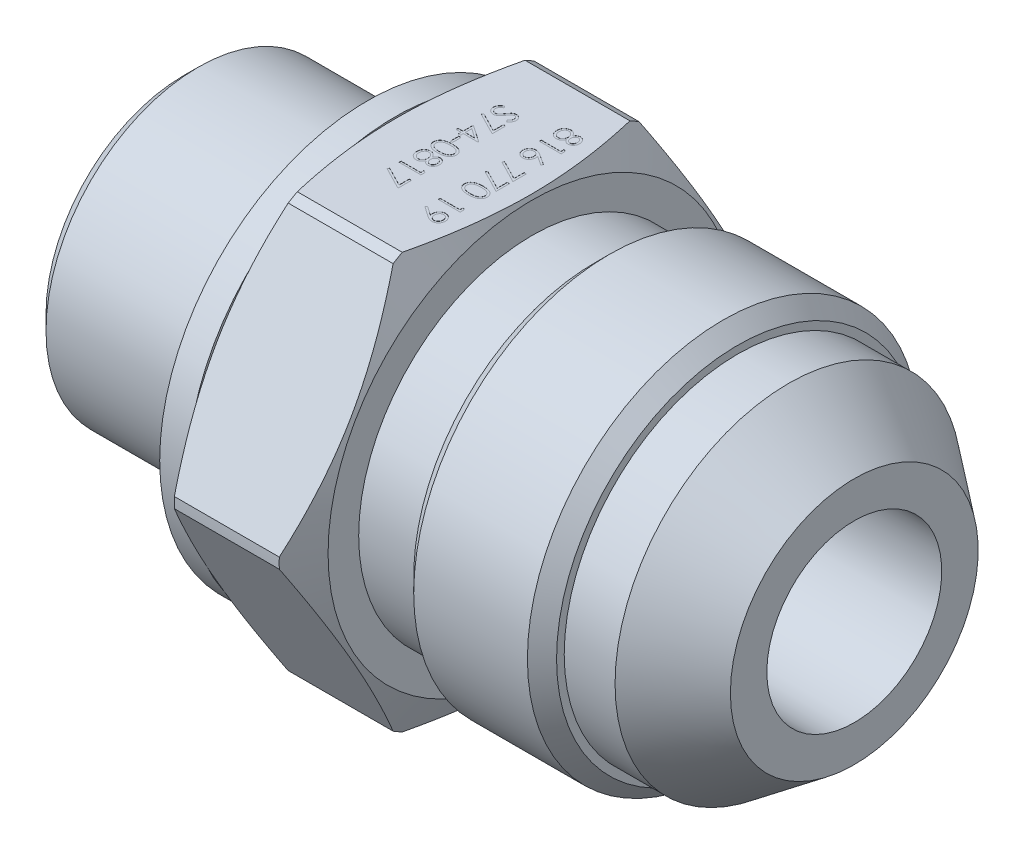
from build123d import *

# Parameters (mm, degrees)
SKETCH2_OUTSIDE_W  = 47.506
SKETCH2_OUTSIDE_H  = 47.506
EXTRUDE1_DEPTH     = 9.4
SKETCH3_R          = 14.25
SKETCH3_R_2        = 11.5
EXTRUDE2_DEPTH     = 1.9
CHAMFER1_SIZE      = 1
CHAMFER2_SIZE      = 1
SKETCH4_W          = 0.153846154
SKETCH4_H          = 0.576923077
CUT_EXTRUDE1_DEPTH = 0.01
SKETCH5_R          = 1.25


with BuildPart() as part:
    # Sketch1 → Revolve1 (revolve)
    with BuildSketch(Plane.XY, mode=Mode.PRIVATE) as revolve1_sk:
        Polygon((0, 7.9), (0, 10.45), (11.55, 10.45), (12.5, 9.5), (14.5, 9.5), (14.5, 14), (15.6, 16.25), (22.8, 16.25), (23.9, 14), (23.9, 11.9), (28.2, 11.9), (28.2, 13.425), (38, 13.425), (38, 11.9), (41.488047606, 11.9), (46, 8.5), (46, 6), (3.290896534, 6), align=None)
    revolve(revolve1_sk.sketch.rotate(Axis((0, 0, 0), (1, 0, 0)), 90), axis=Axis((0, 0, 0), (1, 0, 0)))

    # Sketch2 outside → Extrude1 (cut)
    with BuildSketch(Plane(origin=(23.9, 0, 0), x_dir=(0, 0, -1), z_dir=(1, 0, 0))):
        Rectangle(SKETCH2_OUTSIDE_W, SKETCH2_OUTSIDE_H)
        Polygon((8.227241336, 14.25), (-8.227241336, 14.25), (-16.454482672, 0), (-8.227241336, -14.25), (8.227241336, -14.25), (16.454482672, 0), align=None, mode=Mode.SUBTRACT)
    extrude(amount=-EXTRUDE1_DEPTH, mode=Mode.SUBTRACT)

    # Sketch3 → Extrude2 (add)
    with BuildSketch(Plane.ZY.offset(-14.5)):
        with Locations(Location((0, 0, 0), (0, 0, 180))):
            Circle(SKETCH3_R)
        with Locations(Location((0, 0, 0), (0, 0, 180))):
            Circle(SKETCH3_R_2, mode=Mode.SUBTRACT)
    extrude(amount=EXTRUDE2_DEPTH)

    # Chamfer1
    chamfer1_edges = [part.edges().sort_by_distance(p)[0] for p in [
        (0, 0, -10.45),
    ]]
    chamfer(chamfer1_edges, length=CHAMFER1_SIZE)

    # Chamfer2
    chamfer2_edges = [part.edges().sort_by_distance(p)[0] for p in [
        (28.2, 0, -13.425),
        (38, 0, -13.425),
    ]]
    chamfer(chamfer2_edges, length=CHAMFER2_SIZE)

    # Sketch4 → Cut-Extrude1 (cut)
    # profile 1 of 16: a face of its own
    with BuildSketch(Plane(origin=(0, 14.25, 0), x_dir=(1, 0, 0), z_dir=(0, 1, 0))):
        with BuildLine():
            add(Edge.make_bspline(
                [(21.735637019, 4.509366678), (21.729227212, 4.497192529), (21.716686842, 4.473374603), (21.696559613, 4.439295667), (21.675534084, 4.407919761), (21.654270264, 4.378799736), (21.631927656, 4.352529543), (21.608761289, 4.32893535), (21.585391714, 4.307276947), (21.560904519, 4.288692996), (21.535804758, 4.272305371), (21.509876674, 4.258161919), (21.48320205, 4.246067611), (21.455483119, 4.236483819), (21.4271288, 4.228588677), (21.3977725, 4.223156298), (21.367607789, 4.220234756), (21.347221373, 4.219682408), (21.336899038, 4.219402736)],
                knots=[0, 0, 0, 0, 1.264385854, 2.473688339, 3.635349404, 4.734491366, 5.785876313, 6.801388178, 7.772322209, 8.711311751, 9.622826105, 10.524996139, 11.423212571, 12.31118177, 13.217849097, 14.126010572, 15.051135535, 16, 16, 16, 16], degree=3))
            add(Edge.make_bspline(
                [(21.336899038, 4.219402736), (21.322456161, 4.219730404), (21.293868288, 4.220378981), (21.251691516, 4.226121731), (21.210631818, 4.234503155), (21.171086154, 4.247554843), (21.132558966, 4.263144272), (21.095754694, 4.28319916), (21.059644198, 4.305705114), (21.03743814, 4.32381892), (21.026201923, 4.332984466)],
                knots=[0, 0, 0, 0, 1.02534174, 2.029536028, 3.018826961, 3.997522084, 4.983122576, 5.966563916, 6.971085759, 8, 8, 8, 8], degree=3))
            add(Edge.make_bspline(
                [(21.026201923, 4.332984466), (21.013090306, 4.344914384), (20.987029094, 4.368626798), (20.953193033, 4.409248052), (20.924757578, 4.45382886), (20.901583909, 4.502196717), (20.883547113, 4.554222331), (20.870586034, 4.609894619), (20.863162135, 4.669322113), (20.862088997, 4.710167315), (20.861538462, 4.731121486)],
                knots=[0, 0, 0, 0, 0.954267603, 1.896743057, 2.838368354, 3.796610408, 4.779680527, 5.799409237, 6.871065594, 8, 8, 8, 8], degree=3))
            add(Edge.make_bspline(
                [(20.861538462, 4.731121486), (20.862033706, 4.751269617), (20.862997402, 4.790475833), (20.869491053, 4.847549883), (20.880987296, 4.900816454), (20.89639689, 4.950528083), (20.916945933, 4.99620412), (20.942133121, 5.037927447), (20.971389543, 5.076310199), (21.005420286, 5.110146039), (21.041874677, 5.140183513), (21.07948225, 5.166569931), (21.118248041, 5.188501651), (21.15759361, 5.207070413), (21.198070538, 5.221285278), (21.239470542, 5.231130512), (21.281721318, 5.237383075), (21.310234884, 5.23821499), (21.324579327, 5.238633505)],
                knots=[0, 0, 0, 0, 1.256882982, 2.445766618, 3.576898315, 4.651879663, 5.686612882, 6.692806257, 7.686348993, 8.689277895, 9.678883454, 10.630458183, 11.551151498, 12.454054546, 13.341321255, 14.221808008, 15.105437234, 16, 16, 16, 16], degree=3))
            add(Edge.make_bspline(
                [(21.324579327, 5.238633505), (21.335104703, 5.238385853), (21.355906561, 5.237896407), (21.386639015, 5.234508442), (21.416552071, 5.229062599), (21.445753667, 5.221663321), (21.47404064, 5.211647372), (21.501511827, 5.199510817), (21.5283783, 5.185496446), (21.554178192, 5.168698688), (21.579771328, 5.150205174), (21.603907634, 5.128267663), (21.627931697, 5.104207356), (21.650803997, 5.0770419), (21.673623867, 5.047602762), (21.694939086, 5.014997665), (21.716309228, 4.980142662), (21.729083881, 4.95536856), (21.735637019, 4.942659947)],
                knots=[0, 0, 0, 0, 0.941717298, 1.86116577, 2.762973304, 3.660719123, 4.553575492, 5.444450535, 6.34648071, 7.261375261, 8.197060099, 9.168336537, 10.175980388, 11.237504102, 12.343496232, 13.506792996, 14.721035322, 16, 16, 16, 16], degree=3))
            add(Edge.make_bspline(
                [(21.735637019, 4.942659947), (21.745121871, 4.960058053), (21.763487198, 4.993745654), (21.797255848, 5.038322435), (21.833695599, 5.076673508), (21.874010797, 5.107312609), (21.916425811, 5.131624986), (21.960804719, 5.148793548), (22.006616128, 5.160004831), (22.037856205, 5.161140213), (22.053545673, 5.161710428)],
                knots=[0, 0, 0, 0, 1.16709546, 2.25982348, 3.287408737, 4.277418348, 5.234967981, 6.16072867, 7.076276605, 8, 8, 8, 8], degree=3))
            add(Edge.make_bspline(
                [(22.053545673, 5.161710428), (22.069530324, 5.161009518), (22.10166226, 5.159600568), (22.149493717, 5.148207925), (22.196471198, 5.129641344), (22.242373504, 5.104392807), (22.285621893, 5.072928338), (22.324541722, 5.035187025), (22.358339628, 4.991814641), (22.386893207, 4.943581266), (22.41024827, 4.891776215), (22.426191341, 4.837022914), (22.436677394, 4.780299822), (22.437861271, 4.741685776), (22.438461538, 4.722107062)],
                knots=[0, 0, 0, 0, 0.888753872, 1.786550278, 2.720173491, 3.693036334, 4.694165094, 5.687489879, 6.699912706, 7.744713188, 8.800178723, 9.852977058, 10.911381959, 12, 12, 12, 12], degree=3))
            add(Edge.make_bspline(
                [(22.438461538, 4.722107062), (22.437844332, 4.703033311), (22.436627272, 4.665422046), (22.426377121, 4.61005437), (22.409447808, 4.55703419), (22.386396448, 4.506650821), (22.357650709, 4.460005127), (22.323511842, 4.418357742), (22.284728767, 4.38182522), (22.241597507, 4.351472211), (22.195696313, 4.326977066), (22.147958229, 4.30953278), (22.099022957, 4.298436793), (22.065922847, 4.297030431), (22.049338942, 4.296325812)],
                knots=[0, 0, 0, 0, 1.072712831, 2.115267497, 3.156282165, 4.197922255, 5.225560591, 6.230883479, 7.219814004, 8.214446311, 9.19021444, 10.138875805, 11.067534608, 12, 12, 12, 12], degree=3))
            add(Edge.make_bspline(
                [(22.049338942, 4.296325812), (22.033063133, 4.296940536), (22.001098368, 4.298147818), (21.954502664, 4.308306195), (21.910859511, 4.325407199), (21.869704873, 4.348779674), (21.831608149, 4.379194664), (21.796696001, 4.416600065), (21.763580587, 4.459835031), (21.745159751, 4.492487067), (21.735637019, 4.509366678)],
                knots=[0, 0, 0, 0, 0.975287281, 1.915408787, 2.843441052, 3.776938647, 4.743139116, 5.754296123, 6.83907365, 8, 8, 8, 8], degree=3))
        make_face()
        with BuildLine():
            add(Edge.make_bspline(
                [(22.284615385, 4.729619082), (22.284336196, 4.740140856), (22.28378998, 4.760726046), (22.280936279, 4.790909762), (22.2753849, 4.819612205), (22.267996881, 4.847133263), (22.258016315, 4.873095611), (22.246275596, 4.897851849), (22.232001568, 4.920980644), (22.215989626, 4.942761203), (22.198378381, 4.962368677), (22.180029644, 4.979770628), (22.160583048, 4.994225534), (22.140522322, 5.006500295), (22.119252075, 5.01540666), (22.097424428, 5.022077076), (22.074763549, 5.026586244), (22.059276473, 5.026924125), (22.051442308, 5.027095043)],
                knots=[0, 0, 0, 0, 1.203892937, 2.355340988, 3.463153438, 4.544400666, 5.610487187, 6.640501085, 7.674077295, 8.714426146, 9.728707835, 10.68524104, 11.601827946, 12.495867327, 13.368432065, 14.231010473, 15.105153427, 16, 16, 16, 16], degree=3))
            add(Edge.make_bspline(
                [(22.051442308, 5.027095043), (22.043611333, 5.026790284), (22.028136203, 5.026188037), (22.005192163, 5.021828948), (21.982938654, 5.014540514), (21.961167935, 5.004546505), (21.939935887, 4.991721065), (21.91916115, 4.976154811), (21.899393094, 4.957172327), (21.880070863, 4.936209937), (21.862269005, 4.913312234), (21.846367412, 4.889250914), (21.833690802, 4.863850376), (21.822576005, 4.837871306), (21.814238619, 4.810764309), (21.808232023, 4.782716289), (21.804516569, 4.753757207), (21.804071394, 4.734137291), (21.803846154, 4.724210428)],
                knots=[0, 0, 0, 0, 0.873213166, 1.72559466, 2.594724523, 3.479581045, 4.391597569, 5.35687048, 6.368548091, 7.443976143, 8.534559525, 9.600545123, 10.654815915, 11.696401765, 12.749428718, 13.812189468, 14.893058657, 16, 16, 16, 16], degree=3))
            add(Edge.make_bspline(
                [(21.803846154, 4.724210428), (21.80422024, 4.711460383), (21.804964717, 4.686086226), (21.811886648, 4.648680798), (21.822774899, 4.612311093), (21.837672027, 4.577365848), (21.856369681, 4.544749598), (21.878755261, 4.515675283), (21.904311874, 4.4903909), (21.93264166, 4.46915921), (21.962792341, 4.452697847), (21.99304961, 4.439882787), (22.02373628, 4.432399409), (22.04429355, 4.431423309), (22.054447115, 4.430941197)],
                knots=[0, 0, 0, 0, 1.076279235, 2.141928126, 3.20205304, 4.278698113, 5.344010996, 6.36967002, 7.368914609, 8.37248503, 9.349703398, 10.264243087, 11.142681841, 12, 12, 12, 12], degree=3))
            add(Edge.make_bspline(
                [(22.054447115, 4.430941197), (22.06157376, 4.431168564), (22.075719129, 4.431619854), (22.096601945, 4.435357117), (22.117033984, 4.441484989), (22.137020197, 4.449937267), (22.156841628, 4.460408135), (22.175661484, 4.473934571), (22.194527136, 4.489289359), (22.212602519, 4.507126558), (22.229622691, 4.527235058), (22.244264416, 4.549932315), (22.256980518, 4.57464098), (22.267198081, 4.601562635), (22.274893502, 4.63059223), (22.280650251, 4.661618885), (22.283896352, 4.694894751), (22.284370509, 4.717793263), (22.284615385, 4.729619082)],
                knots=[0, 0, 0, 0, 0.814272661, 1.61621452, 2.416847352, 3.248328223, 4.093649164, 4.973549185, 5.892801723, 6.872536627, 7.872406081, 8.898230315, 9.953166191, 11.044090313, 12.18293744, 13.382234284, 14.648068262, 16, 16, 16, 16], degree=3))
        make_face(mode=Mode.SUBTRACT)
        with BuildLine():
            add(Edge.make_bspline(
                [(21.65, 4.720905139), (21.649762814, 4.73424481), (21.649297514, 4.760413987), (21.644115035, 4.798751995), (21.636907042, 4.835548669), (21.625948595, 4.870665455), (21.611817304, 4.904059301), (21.594528032, 4.935805432), (21.574396359, 4.96594877), (21.551312299, 4.993995413), (21.526311676, 5.019548826), (21.500183315, 5.042361609), (21.472739547, 5.061350684), (21.444225177, 5.076867231), (21.41467573, 5.088886828), (21.384097138, 5.097761965), (21.352398006, 5.102913852), (21.330907491, 5.103647978), (21.320072115, 5.10401812)],
                knots=[0, 0, 0, 0, 1.140506561, 2.237395584, 3.304560074, 4.345354409, 5.3782877, 6.402081073, 7.433555996, 8.474808822, 9.504965884, 10.489266388, 11.437701257, 12.354123303, 13.261162422, 14.161620169, 15.073101032, 16, 16, 16, 16], degree=3))
            add(Edge.make_bspline(
                [(21.320072115, 5.10401812), (21.306600865, 5.103435478), (21.279874219, 5.10227953), (21.240388555, 5.093059906), (21.202054733, 5.078378233), (21.165547242, 5.057395917), (21.131320863, 5.031958056), (21.101144331, 5.000882386), (21.074910086, 4.96538361), (21.053399371, 4.925107619), (21.036144444, 4.881173356), (21.024403841, 4.833466956), (21.016572883, 4.782661951), (21.015786946, 4.747578671), (21.015384615, 4.729619082)],
                knots=[0, 0, 0, 0, 0.898956152, 1.783507998, 2.694187257, 3.631865312, 4.587204618, 5.533364321, 6.51415483, 7.525942309, 8.574485006, 9.65837228, 10.801290154, 12, 12, 12, 12], degree=3))
            add(Edge.make_bspline(
                [(21.015384615, 4.729619082), (21.015653799, 4.715583089), (21.016178256, 4.688236474), (21.020817181, 4.64834417), (21.028151968, 4.610690544), (21.038922167, 4.575294072), (21.051825517, 4.541730575), (21.068700368, 4.510750596), (21.087784429, 4.481528977), (21.110435556, 4.455437474), (21.13465967, 4.431709226), (21.160172053, 4.410926327), (21.18671288, 4.393337311), (21.214267717, 4.379158946), (21.242735021, 4.367899951), (21.272231724, 4.359783502), (21.302873667, 4.354781105), (21.323658829, 4.354274776), (21.334194712, 4.35401812)],
                knots=[0, 0, 0, 0, 1.22469164, 2.386092043, 3.500511288, 4.568136916, 5.611981868, 6.63276519, 7.641422348, 8.65223666, 9.641383647, 10.598487484, 11.519869765, 12.415254456, 13.298392158, 14.187051141, 15.081026348, 16, 16, 16, 16], degree=3))
            add(Edge.make_bspline(
                [(21.334194712, 4.35401812), (21.344429005, 4.354403797), (21.364609244, 4.355164284), (21.394492543, 4.360059763), (21.423480635, 4.368465352), (21.451448778, 4.380716047), (21.478699251, 4.395782796), (21.505030716, 4.414264174), (21.530234353, 4.436376683), (21.554336448, 4.461422688), (21.576630662, 4.488701786), (21.596350674, 4.517702862), (21.612958846, 4.548197402), (21.626465882, 4.580122268), (21.637089093, 4.613406204), (21.644510231, 4.648024828), (21.64918149, 4.684018645), (21.649724081, 4.708470732), (21.65, 4.720905139)],
                knots=[0, 0, 0, 0, 0.917481483, 1.809113215, 2.707052678, 3.61610275, 4.54058801, 5.494688304, 6.493986409, 7.541809048, 8.607637092, 9.648666143, 10.681335566, 11.715370464, 12.751897579, 13.808646822, 14.885650252, 16, 16, 16, 16], degree=3))
        make_face(mode=Mode.SUBTRACT)
    # profile 2 of 16: a face of its own
    with BuildSketch(Plane(origin=(0, 14.25, 0), x_dir=(1, 0, 0), z_dir=(0, 1, 0))):
        Polygon((22.4, 3.765977255), (22.4, 3.488633505), (20.9, 3.488633505), (20.9, 3.623248889), (22.246153846, 3.623248889), (22.246153846, 3.85401812), align=None)
    # profile 3 of 16: a face of its own
    with BuildSketch(Plane(origin=(0, 14.25, 0), x_dir=(1, 0, 0), z_dir=(0, 1, 0))):
        with BuildLine():
            Line((22.438461538, 2.238633505), (22.35703125, 2.134967639))
            Line((22.35703125, 2.134967639), (21.750961538, 2.531301774))
            add(Edge.make_bspline(
                [(21.750961538, 2.531301774), (21.755167479, 2.504914512), (21.763371641, 2.453443175), (21.764725046, 2.401343504), (21.765384615, 2.375953216)],
                knots=[0, 0, 0, 0, 1.025318673, 2, 2, 2, 2], degree=3))
            add(Edge.make_bspline(
                [(21.765384615, 2.375953216), (21.764974853, 2.360707861), (21.764168249, 2.330697832), (21.757960884, 2.286637774), (21.748178693, 2.244299658), (21.733919155, 2.203858968), (21.71570386, 2.165170547), (21.693872916, 2.128012377), (21.667299053, 2.093082944), (21.637614072, 2.059932439), (21.604735364, 2.029835111), (21.569849077, 2.00318823), (21.532991557, 1.98080532), (21.494181471, 1.962645067), (21.453478646, 1.948542977), (21.410935157, 1.938262557), (21.366521669, 1.932185589), (21.336316737, 1.931360379), (21.320973558, 1.930941197)],
                knots=[0, 0, 0, 0, 1.04369286, 2.054478336, 3.041073146, 4.015093852, 4.984733326, 5.965804835, 6.960378782, 7.985147595, 9.009457201, 10.008161701, 10.986880575, 11.956520048, 12.937015923, 13.931873656, 14.949455224, 16, 16, 16, 16], degree=3))
            add(Edge.make_bspline(
                [(21.320973558, 1.930941197), (21.299994734, 1.931723995), (21.258737716, 1.933263448), (21.198395966, 1.944470012), (21.141371071, 1.963810037), (21.087438931, 1.989684672), (21.038168706, 2.023254976), (20.993641634, 2.063037632), (20.95482975, 2.109408697), (20.921534651, 2.161270094), (20.895081737, 2.217400232), (20.875524557, 2.276254517), (20.863838646, 2.337329896), (20.862308716, 2.378808481), (20.861538462, 2.399691197)],
                knots=[0, 0, 0, 0, 1.031881447, 2.029301251, 3.006342947, 3.987068354, 4.962916383, 5.929513747, 6.915671209, 7.928552063, 8.953527267, 9.960179832, 10.973036711, 12, 12, 12, 12], degree=3))
            add(Edge.make_bspline(
                [(20.861538462, 2.399691197), (20.862193405, 2.419875501), (20.863490734, 2.459857074), (20.875047589, 2.518671072), (20.893779113, 2.575184009), (20.919585577, 2.628998647), (20.95218053, 2.678853355), (20.991426233, 2.723441789), (21.036455312, 2.762608814), (21.087405898, 2.795032182), (21.141803039, 2.821457314), (21.199040647, 2.840095342), (21.257966794, 2.852148603), (21.298078513, 2.853392161), (21.318269231, 2.85401812)],
                knots=[0, 0, 0, 0, 1.011913813, 2.004424092, 2.994488568, 3.992479987, 4.990471406, 5.973328987, 6.963763268, 7.974390938, 8.994854117, 9.989689954, 10.988086187, 12, 12, 12, 12], degree=3))
            add(Edge.make_bspline(
                [(21.318269231, 2.85401812), (21.333711285, 2.853474499), (21.365226978, 2.852365024), (21.413096452, 2.845743801), (21.461885265, 2.833599669), (21.503244831, 2.820457064), (21.537498045, 2.807415633), (21.564546903, 2.795323317), (21.593111365, 2.781802635), (21.622650965, 2.765954513), (21.654009711, 2.749154225), (21.686026295, 2.729529581), (21.71987006, 2.709050965), (21.742402714, 2.694048852), (21.753966346, 2.686349851)],
                knots=[0, 0, 0, 0, 1.17367173, 2.395347028, 3.66355231, 4.98980831, 5.690886799, 6.447442954, 7.240630024, 8.091733897, 8.994365608, 9.943299771, 10.944512865, 12, 12, 12, 12], degree=3))
            Line((21.753966346, 2.686349851), (22.438461538, 2.238633505))
        make_face()
        with BuildLine():
            add(Edge.make_bspline(
                [(21.611538462, 2.404198409), (21.611200597, 2.415624726), (21.61053771, 2.438043068), (21.606793718, 2.470892524), (21.599699879, 2.501898458), (21.590523836, 2.531415007), (21.57803001, 2.559134533), (21.563033878, 2.585373231), (21.545204456, 2.609870739), (21.52474054, 2.632196838), (21.502662786, 2.65269771), (21.478873862, 2.670331808), (21.454100562, 2.685559569), (21.428110047, 2.69793647), (21.400918988, 2.707575348), (21.372650657, 2.714547381), (21.343115977, 2.718427581), (21.323087758, 2.719073106), (21.312860577, 2.719402736)],
                knots=[0, 0, 0, 0, 1.129474985, 2.216020618, 3.260639938, 4.268601163, 5.26556745, 6.258792394, 7.250684778, 8.252748164, 9.247500881, 10.223461414, 11.174097059, 12.117127289, 13.062595836, 14.020469732, 14.98917545, 16, 16, 16, 16], degree=3))
            add(Edge.make_bspline(
                [(21.312860577, 2.719402736), (21.302725257, 2.719133603), (21.282851404, 2.718605875), (21.253557678, 2.71383618), (21.225393368, 2.706498408), (21.198337873, 2.695757855), (21.172538778, 2.68228606), (21.147812823, 2.665707532), (21.124142941, 2.646302983), (21.102126005, 2.623745581), (21.081931536, 2.59941961), (21.063950342, 2.573693284), (21.048850948, 2.546648404), (21.036913687, 2.518130647), (21.027136785, 2.488539287), (21.020251936, 2.457648579), (21.01636065, 2.425431381), (21.01571423, 2.403607729), (21.015384615, 2.392479659)],
                knots=[0, 0, 0, 0, 0.989642335, 1.94054129, 2.892446913, 3.828371744, 4.778262963, 5.730973156, 6.732161388, 7.763274768, 8.805796303, 9.818398792, 10.825975928, 11.825728216, 12.834635236, 13.867465554, 14.912602056, 16, 16, 16, 16], degree=3))
            add(Edge.make_bspline(
                [(21.015384615, 2.392479659), (21.015714204, 2.38135157), (21.016360573, 2.359527882), (21.020252227, 2.327310944), (21.027135718, 2.296419278), (21.036917555, 2.266831399), (21.048836597, 2.238300789), (21.064044957, 2.211232235), (21.081822209, 2.185260291), (21.102160762, 2.160950279), (21.124018536, 2.138298593), (21.148027137, 2.119348542), (21.172342259, 2.10224626), (21.198440681, 2.089291879), (21.225377081, 2.07843171), (21.253562042, 2.07113096), (21.282850261, 2.066351394), (21.302724871, 2.065825022), (21.312860577, 2.065556582)],
                knots=[0, 0, 0, 0, 1.087205562, 2.132157158, 3.164804748, 4.173533273, 5.173108684, 6.180507559, 7.20098426, 8.243321352, 9.274252308, 10.269075238, 11.227079059, 12.172305571, 13.108064818, 14.05980203, 15.010532752, 16, 16, 16, 16], degree=3))
            add(Edge.make_bspline(
                [(21.312860577, 2.065556582), (21.323102287, 2.065789673), (21.343203434, 2.066247155), (21.372624048, 2.07152173), (21.401148857, 2.078645921), (21.428135293, 2.090159267), (21.454329641, 2.103872603), (21.478983246, 2.121342491), (21.502794549, 2.141372146), (21.524886963, 2.164568429), (21.545094483, 2.189803909), (21.562931005, 2.216640003), (21.57798468, 2.244714627), (21.590544836, 2.274000661), (21.599608905, 2.304833309), (21.606746007, 2.336714888), (21.610544015, 2.370053133), (21.611202757, 2.39267168), (21.611538462, 2.404198409)],
                knots=[0, 0, 0, 0, 0.978265087, 1.920016216, 2.851775529, 3.783928695, 4.718195979, 5.674835085, 6.667117013, 7.690134047, 8.732874136, 9.755756613, 10.767227014, 11.776017537, 12.797239016, 13.836276431, 14.897336092, 16, 16, 16, 16], degree=3))
        make_face(mode=Mode.SUBTRACT)
    # profile 4 of 16: a face of its own
    with BuildSketch(Plane(origin=(0, 14.25, 0), x_dir=(1, 0, 0), z_dir=(0, 1, 0))):
        Polygon((22.4, 1.10401812), (22.4, 0.180941197), (20.861538462, 0.969402736), (20.925540865, 1.085688793), (22.246153846, 0.40870562), (22.246153846, 1.10401812), align=None)
    # profile 5 of 16: a face of its own
    with BuildSketch(Plane(origin=(0, 14.25, 0), x_dir=(1, 0, 0), z_dir=(0, 1, 0))):
        Polygon((22.4, -0.049828034), (22.4, -0.972904957), (20.861538462, -0.184443418), (20.925540865, -0.068157361), (22.246153846, -0.745140534), (22.246153846, -0.049828034), align=None)
    # profile 6 of 16: a face of its own
    with BuildSketch(Plane(origin=(0, 14.25, 0), x_dir=(1, 0, 0), z_dir=(0, 1, 0))):
        with BuildLine():
            add(Edge.make_bspline(
                [(21.649399038, -1.107520341), (21.673440776, -1.107660921), (21.720142198, -1.107933998), (21.788192759, -1.110971892), (21.852032883, -1.116018467), (21.911665624, -1.122934485), (21.967106384, -1.131350759), (22.018206983, -1.14258598), (22.065203995, -1.155362854), (22.10825046, -1.170171184), (22.147927057, -1.186879757), (22.184964882, -1.205067561), (22.219316911, -1.225446473), (22.251499205, -1.246886599), (22.281152593, -1.270171419), (22.30822092, -1.295055334), (22.332720528, -1.321785184), (22.354943007, -1.349832313), (22.374301618, -1.379373971), (22.391745014, -1.409499486), (22.406061876, -1.440740449), (22.417825741, -1.472811931), (22.427251829, -1.505620666), (22.433779376, -1.539302216), (22.437870393, -1.573864719), (22.438262621, -1.597192215), (22.438461538, -1.609022745)],
                knots=[0, 0, 0, 0, 1.646377244, 3.198111528, 4.663803227, 6.031090796, 7.308794487, 8.502186765, 9.612154809, 10.642545331, 11.617106989, 12.558866172, 13.465886467, 14.35053239, 15.20542558, 16.045215227, 16.865619885, 17.686225247, 18.492864914, 19.282407821, 20.068097601, 20.842842034, 21.620163247, 22.403093475, 23.190129512, 24, 24, 24, 24], degree=3))
            add(Edge.make_bspline(
                [(22.438461538, -1.609022745), (22.438252475, -1.620952236), (22.437836713, -1.64467624), (22.433840738, -1.679750686), (22.427210256, -1.714014836), (22.417815553, -1.747322609), (22.406160263, -1.779947604), (22.391551498, -1.811634635), (22.37454627, -1.842580528), (22.354564608, -1.872293508), (22.332286489, -1.901099772), (22.307102489, -1.928291756), (22.279266895, -1.953871935), (22.249077524, -1.978161352), (22.215955345, -2.000470894), (22.180476441, -2.02171665), (22.142020356, -2.040733237), (22.101228727, -2.059048098), (22.056972873, -2.074856807), (22.009502262, -2.089113769), (21.958256181, -2.100633327), (21.903503505, -2.110228729), (21.845043155, -2.117662256), (21.783000448, -2.123076246), (21.717334567, -2.125936139), (21.672438346, -2.126474725), (21.649399038, -2.126751111)],
                knots=[0, 0, 0, 0, 0.810914788, 1.612654377, 2.396697861, 3.181598691, 3.963628158, 4.749916497, 5.551656086, 6.361998678, 7.18212741, 8.025565596, 8.878627764, 9.750805457, 10.657531673, 11.591944965, 12.560506719, 13.57287815, 14.630710178, 15.753379473, 16.941251878, 18.199788006, 19.531962791, 20.947069417, 22.433333509, 24, 24, 24, 24], degree=3))
            add(Edge.make_bspline(
                [(21.649399038, -2.126751111), (21.626460307, -2.126471515), (21.581765123, -2.125926734), (21.51639352, -2.123112057), (21.454684236, -2.117541605), (21.396465496, -2.110651836), (21.342082962, -2.100837454), (21.291019524, -2.089680231), (21.24371585, -2.075813002), (21.199693398, -2.060219766), (21.159101622, -2.04230232), (21.120977972, -2.023117662), (21.085528017, -2.002002316), (21.052406319, -1.979559725), (21.021955129, -1.955476766), (20.994099186, -1.929788269), (20.968856866, -1.902474682), (20.946274359, -1.873603291), (20.926525297, -1.843422883), (20.908872813, -1.812580285), (20.894548917, -1.780459904), (20.882454974, -1.747775592), (20.873038657, -1.714218949), (20.866591369, -1.679822891), (20.862057108, -1.644700063), (20.861711942, -1.620956363), (20.861538462, -1.609022745)],
                knots=[0, 0, 0, 0, 1.56130642, 3.042141888, 4.451772327, 5.777565838, 7.030558081, 8.211376819, 9.333164717, 10.383253789, 11.387583522, 12.350962576, 13.286244149, 14.193812918, 15.072134482, 15.925989337, 16.770211267, 17.600669898, 18.417446232, 19.22325363, 20.01647746, 20.807971184, 21.593601364, 22.38506573, 23.188331689, 24, 24, 24, 24], degree=3))
            add(Edge.make_bspline(
                [(20.861538462, -1.609022745), (20.861739294, -1.597192696), (20.862135295, -1.573866148), (20.866198664, -1.539296703), (20.87282465, -1.505667682), (20.881822705, -1.472911859), (20.893258701, -1.440962198), (20.907804863, -1.410131678), (20.924676148, -1.380013134), (20.943870392, -1.350743997), (20.965866496, -1.322882119), (20.990193534, -1.296267869), (21.017461677, -1.271573246), (21.047234457, -1.248580259), (21.079259252, -1.226761164), (21.11385153, -1.20658195), (21.151236377, -1.188429622), (21.191132001, -1.171346597), (21.234494836, -1.156287942), (21.281742511, -1.14308667), (21.333136389, -1.132081564), (21.388523897, -1.1232312), (21.44794649, -1.115934966), (21.511508794, -1.110995789), (21.579155969, -1.107931578), (21.62555741, -1.107659922), (21.649399038, -1.107520341)],
                knots=[0, 0, 0, 0, 0.810940842, 1.599017053, 2.38298203, 3.159479784, 3.926441347, 4.70693857, 5.494146311, 6.292334103, 7.104379492, 7.925868426, 8.762126819, 9.623561095, 10.503686106, 11.41783325, 12.366995289, 13.351843594, 14.392337808, 15.512229747, 16.713911458, 17.994391108, 19.357476964, 20.818259213, 22.365182633, 24, 24, 24, 24], degree=3))
        make_face()
        with BuildLine():
            add(Edge.make_bspline(
                [(21.65, -1.242135726), (21.629964843, -1.242186918), (21.591080538, -1.24228627), (21.534576284, -1.244881785), (21.481874714, -1.248417598), (21.432908914, -1.252978156), (21.387844619, -1.259750844), (21.34637191, -1.26733948), (21.308710197, -1.276574332), (21.274601265, -1.287500913), (21.243465508, -1.299945748), (21.214495103, -1.313535695), (21.187338808, -1.328127059), (21.162272442, -1.344485526), (21.139046486, -1.362240049), (21.117727685, -1.381419783), (21.098409059, -1.401990998), (21.075485637, -1.430468301), (21.051517133, -1.467878502), (21.03090239, -1.515255717), (21.017863499, -1.563959169), (21.016209952, -1.597025517), (21.015384615, -1.613529957)],
                knots=[0, 0, 0, 0, 1.459116078, 2.831857795, 4.118796693, 5.306371758, 6.412361096, 7.436813035, 8.376339383, 9.234574298, 10.043323891, 10.816788787, 11.564361537, 12.286735248, 12.994408768, 13.691741332, 14.372975427, 15.047457468, 16.352811911, 17.594285292, 18.799233213, 20, 20, 20, 20], degree=3))
            add(Edge.make_bspline(
                [(21.015384615, -1.613529957), (21.016069379, -1.630140387), (21.017437491, -1.663326955), (21.03063695, -1.711812867), (21.050552467, -1.758882983), (21.074101398, -1.795770957), (21.096527825, -1.823834904), (21.115648388, -1.843942186), (21.137058046, -1.862397349), (21.160157744, -1.879901096), (21.185388809, -1.895954985), (21.212629912, -1.910553473), (21.241956703, -1.923874907), (21.262429448, -1.931464499), (21.272896635, -1.935344861)],
                knots=[0, 0, 0, 0, 1.353760809, 2.704726607, 4.075137775, 5.516104923, 6.260822281, 7.007110065, 7.778089737, 8.566572457, 9.372053459, 10.217411131, 11.088608312, 12, 12, 12, 12], degree=3))
            add(Edge.make_bspline(
                [(21.272896635, -1.935344861), (21.286280809, -1.939867047), (21.313456422, -1.949049024), (21.355612273, -1.960882642), (21.399842029, -1.970202099), (21.445881365, -1.978586398), (21.494069808, -1.984309136), (21.544258258, -1.988915342), (21.596484556, -1.991628494), (21.631968124, -1.991964815), (21.65, -1.992135726)],
                knots=[0, 0, 0, 0, 0.884706709, 1.796334032, 2.740027952, 3.714592787, 4.726048262, 5.777819803, 6.87074269, 8, 8, 8, 8], degree=3))
            add(Edge.make_bspline(
                [(21.65, -1.992135726), (21.668031489, -1.99194723), (21.703309298, -1.991578446), (21.754920766, -1.989155501), (21.804026198, -1.98526203), (21.850670142, -1.979992302), (21.894769577, -1.97275808), (21.936387608, -1.9640705), (21.975513016, -1.953885309), (22.012246701, -1.942202591), (22.046456634, -1.92903633), (22.078217296, -1.914491559), (22.107697062, -1.898970317), (22.134811316, -1.882108763), (22.159682443, -1.864110763), (22.181811545, -1.844500346), (22.201884534, -1.824055625), (22.224797063, -1.795419685), (22.248159219, -1.757930705), (22.26965883, -1.71128257), (22.282005241, -1.662738008), (22.283745964, -1.629920814), (22.284615385, -1.613529957)],
                knots=[0, 0, 0, 0, 1.313668642, 2.570134578, 3.763346207, 4.902004944, 5.98888779, 7.017888835, 7.998425394, 8.933058446, 9.82474457, 10.667209444, 11.476765193, 12.250262638, 12.991704352, 13.7104269, 14.401925311, 15.076585796, 16.378385137, 17.609787933, 18.806186071, 20, 20, 20, 20], degree=3))
            add(Edge.make_bspline(
                [(22.284615385, -1.613529957), (22.283745886, -1.596939006), (22.282005306, -1.563726881), (22.269691205, -1.51468831), (22.248359385, -1.467707879), (22.224646198, -1.430519669), (22.202290151, -1.401919859), (22.182849247, -1.3817244), (22.161465953, -1.362843749), (22.13833833, -1.345074434), (22.113259321, -1.328731715), (22.086106976, -1.31413438), (22.057133878, -1.300552233), (22.026005205, -1.28808068), (21.991844852, -1.27725536), (21.954373214, -1.267579521), (21.912861768, -1.259995488), (21.867671485, -1.25337734), (21.81864549, -1.248331377), (21.765822419, -1.244890862), (21.70922045, -1.242281574), (21.670135518, -1.242185316), (21.65, -1.242135726)],
                knots=[0, 0, 0, 0, 1.207964612, 2.418129846, 3.655795183, 4.951004962, 5.620895151, 6.296795572, 6.989224116, 7.696855977, 8.419187164, 9.166715907, 9.940135271, 10.748837255, 11.607021648, 12.548275234, 13.5654991, 14.678641405, 15.874140913, 17.15372626, 18.533675393, 20, 20, 20, 20], degree=3))
        make_face(mode=Mode.SUBTRACT)
    # profile 7 of 16: a face of its own
    with BuildSketch(Plane(origin=(0, 14.25, 0), x_dir=(1, 0, 0), z_dir=(0, 1, 0))):
        Polygon((22.4, -3.157099668), (22.4, -3.434443418), (20.9, -3.434443418), (20.9, -3.299828034), (22.246153846, -3.299828034), (22.246153846, -3.069058803), align=None)
    # profile 8 of 16: a face of its own
    with BuildSketch(Plane(origin=(0, 14.25, 0), x_dir=(1, 0, 0), z_dir=(0, 1, 0))):
        with BuildLine():
            Line((20.861538462, -4.319058803), (20.936358173, -4.211486688))
            Line((20.936358173, -4.211486688), (21.546033654, -4.628553995))
            add(Edge.make_bspline(
                [(21.546033654, -4.628553995), (21.542779484, -4.60194368), (21.536371842, -4.549546486), (21.535194704, -4.496773442), (21.534615385, -4.470801591)],
                knots=[0, 0, 0, 0, 1.015715272, 2, 2, 2, 2], degree=3))
            add(Edge.make_bspline(
                [(21.534615385, -4.470801591), (21.535019899, -4.455055435), (21.535813926, -4.424147107), (21.542071976, -4.378698776), (21.55181962, -4.334963648), (21.566027478, -4.293108312), (21.584185494, -4.253170053), (21.606304326, -4.215009506), (21.632466308, -4.178677199), (21.662390223, -4.144600652), (21.695253452, -4.113610427), (21.730034129, -4.086000307), (21.767138197, -4.063054143), (21.80580827, -4.04399274), (21.846600283, -4.029536833), (21.889050025, -4.019010031), (21.933455014, -4.012529022), (21.96368007, -4.011757981), (21.979026442, -4.011366495)],
                knots=[0, 0, 0, 0, 1.060702494, 2.082066239, 3.085748733, 4.076089625, 5.054723785, 6.037561548, 7.043420247, 8.066922603, 9.088643095, 10.08373341, 11.053858765, 12.022809492, 12.983497605, 13.964038393, 14.966267459, 16, 16, 16, 16], degree=3))
            add(Edge.make_bspline(
                [(21.979026442, -4.011366495), (22.000013008, -4.012109824), (22.041205378, -4.013568829), (22.101391279, -4.025311051), (22.158299798, -4.044622624), (22.21178131, -4.071549072), (22.261066484, -4.105463952), (22.305470173, -4.146224777), (22.344360825, -4.193583618), (22.377791144, -4.246461627), (22.404677571, -4.303612921), (22.424494414, -4.363470918), (22.436151021, -4.425576969), (22.437687818, -4.467648828), (22.438461538, -4.488830438)],
                knots=[0, 0, 0, 0, 1.022988612, 2.007919123, 2.978103895, 3.94594894, 4.918897164, 5.887013414, 6.875921846, 7.89917871, 8.930658928, 9.948724884, 10.967259574, 12, 12, 12, 12], degree=3))
            add(Edge.make_bspline(
                [(22.438461538, -4.488830438), (22.437680001, -4.509611999), (22.436135758, -4.550674405), (22.424726863, -4.611137517), (22.405703282, -4.669099459), (22.379293114, -4.724104195), (22.345974024, -4.774769382), (22.306598979, -4.820504303), (22.260724311, -4.860083714), (22.209604828, -4.893439577), (22.154675009, -4.920211709), (22.097339335, -4.939528597), (22.038008378, -4.951419534), (21.997810756, -4.952917967), (21.977524038, -4.953674188)],
                knots=[0, 0, 0, 0, 1.026337322, 2.02794581, 3.027878252, 4.032696425, 5.033228651, 6.015458494, 7.004668777, 8.016190509, 9.023163053, 10.0152653, 10.998354841, 12, 12, 12, 12], degree=3))
            add(Edge.make_bspline(
                [(21.977524038, -4.953674188), (21.961775449, -4.953175393), (21.929833375, -4.952163714), (21.881349122, -4.944895885), (21.831811136, -4.933124791), (21.789826792, -4.919470824), (21.755503033, -4.905489122), (21.727957349, -4.893459705), (21.699211271, -4.879458383), (21.669476073, -4.862826864), (21.637969424, -4.845439213), (21.605379391, -4.825669133), (21.57152386, -4.804118297), (21.548704359, -4.788761477), (21.537019231, -4.780897745)],
                knots=[0, 0, 0, 0, 1.179688711, 2.392703466, 3.66501481, 4.991562144, 5.695278944, 6.441221078, 7.243328977, 8.089575748, 8.993388627, 9.939305498, 10.944784961, 12, 12, 12, 12], degree=3))
            Line((21.537019231, -4.780897745), (20.861538462, -4.319058803))
        make_face()
        with BuildLine():
            add(Edge.make_bspline(
                [(21.688461538, -4.495741495), (21.688787417, -4.507670358), (21.689421792, -4.5308918), (21.693282896, -4.564910642), (21.70012889, -4.597021015), (21.709951624, -4.627308693), (21.721804482, -4.656077366), (21.736895333, -4.682870078), (21.754902462, -4.707709253), (21.775135326, -4.730761222), (21.797614148, -4.751231507), (21.821141479, -4.769464235), (21.845820598, -4.784961621), (21.871960567, -4.797203025), (21.898925085, -4.807267843), (21.92714838, -4.81421842), (21.956483409, -4.818068848), (21.976411405, -4.818725237), (21.986538462, -4.819058803)],
                knots=[0, 0, 0, 0, 1.163407946, 2.26475976, 3.333800367, 4.359385343, 5.366239384, 6.363380779, 7.350133999, 8.353570782, 9.349036268, 10.310270964, 11.253520213, 12.184142, 13.120487599, 14.056272588, 15.012232024, 16, 16, 16, 16], degree=3))
            add(Edge.make_bspline(
                [(21.986538462, -4.819058803), (21.996669769, -4.818771828), (22.016634752, -4.818206308), (22.046012894, -4.81366852), (22.074168333, -4.805687675), (22.101248095, -4.794972261), (22.127056306, -4.78088316), (22.151761307, -4.763913631), (22.175668462, -4.744148373), (22.197546519, -4.720952498), (22.217974294, -4.695995946), (22.235683005, -4.669162094), (22.250799343, -4.641116554), (22.263166534, -4.611836979), (22.272836473, -4.581262422), (22.279785425, -4.54939123), (22.28363083, -4.516067733), (22.28428302, -4.493447148), (22.284615385, -4.48191938)],
                knots=[0, 0, 0, 0, 0.972051712, 1.915547132, 2.843788449, 3.775556853, 4.704594175, 5.659091977, 6.648619647, 7.675179132, 8.714041218, 9.74046568, 10.755438548, 11.767722258, 12.786148662, 13.828784001, 14.893517844, 16, 16, 16, 16], degree=3))
            add(Edge.make_bspline(
                [(22.284615385, -4.48191938), (22.284282543, -4.470491839), (22.283629511, -4.448071099), (22.279792053, -4.415044258), (22.272792214, -4.383387059), (22.263161864, -4.35290663), (22.250866611, -4.32368877), (22.235683119, -4.295866317), (22.217879704, -4.269312084), (22.197572532, -4.244362649), (22.175563429, -4.22121651), (22.151865767, -4.201103164), (22.127043227, -4.184172957), (22.101251571, -4.17006432), (22.074167405, -4.159354102), (22.046013146, -4.151371866), (22.016634687, -4.146834452), (21.996669747, -4.146268881), (21.986538462, -4.14598188)],
                knots=[0, 0, 0, 0, 1.099545523, 2.15729926, 3.193054709, 4.213957097, 5.228701859, 6.237665598, 7.258567987, 8.299955741, 9.329010984, 10.327149711, 11.283968076, 12.215264062, 13.149297769, 14.079795814, 15.025585048, 16, 16, 16, 16], degree=3))
            add(Edge.make_bspline(
                [(21.986538462, -4.14598188), (21.976403519, -4.146241562), (21.956415558, -4.146753704), (21.927047104, -4.151694185), (21.898895021, -4.159956305), (21.871685575, -4.171021758), (21.84568335, -4.185593869), (21.821011623, -4.203475518), (21.797390716, -4.224435037), (21.775187625, -4.248192246), (21.754808122, -4.274192887), (21.737009386, -4.301962921), (21.721978339, -4.331024279), (21.709917746, -4.361479264), (21.700227033, -4.393102178), (21.693295513, -4.426177235), (21.689458828, -4.460595051), (21.688797158, -4.483913614), (21.688461538, -4.495741495)],
                knots=[0, 0, 0, 0, 0.952633368, 1.87876736, 2.791047057, 3.707742249, 4.635551637, 5.587206343, 6.568248508, 7.601284464, 8.641511608, 9.671105535, 10.699146789, 11.713763218, 12.747829548, 13.806491675, 14.887386225, 16, 16, 16, 16], degree=3))
        make_face(mode=Mode.SUBTRACT)
    # profile 9 of 16: a face of its own
    with BuildSketch(Plane(origin=(0, 14.25, 0), x_dir=(1, 0, 0), z_dir=(0, 1, 0))):
        with BuildLine():
            Line((17.631670673, 4.392479659), (17.707692308, 4.265676774))
            add(Edge.make_bspline(
                [(17.707692308, 4.265676774), (17.687950428, 4.253883244), (17.65012575, 4.231287295), (17.599015161, 4.193593855), (17.555574237, 4.154536893), (17.52005569, 4.113827179), (17.492091882, 4.071713201), (17.472290925, 4.027920035), (17.459941222, 3.982595259), (17.458441185, 3.951749336), (17.457692308, 3.936349851)],
                knots=[0, 0, 0, 0, 1.272034388, 2.437168799, 3.508375237, 4.49857839, 5.41946034, 6.295179144, 7.148887113, 8, 8, 8, 8], degree=3))
            add(Edge.make_bspline(
                [(17.457692308, 3.936349851), (17.458058595, 3.923198338), (17.458784762, 3.897125433), (17.465762255, 3.858741634), (17.476481714, 3.821463644), (17.491833636, 3.786060223), (17.51040693, 3.75301823), (17.532842211, 3.724047498), (17.55795488, 3.698986511), (17.585991571, 3.678542906), (17.616039962, 3.662672403), (17.647159117, 3.651188068), (17.679212152, 3.643878979), (17.700943142, 3.642948679), (17.711899038, 3.642479659)],
                knots=[0, 0, 0, 0, 1.095270387, 2.171376115, 3.241375676, 4.322296363, 5.380636668, 6.392615365, 7.366724986, 8.328592944, 9.273498763, 10.190095884, 11.087518669, 12, 12, 12, 12], degree=3))
            add(Edge.make_bspline(
                [(17.711899038, 3.642479659), (17.724387974, 3.643111506), (17.749776155, 3.64439596), (17.787233149, 3.655252308), (17.824301394, 3.672330557), (17.847230507, 3.688085976), (17.859134615, 3.696265716)],
                knots=[0, 0, 0, 0, 0.938893495, 1.908633276, 2.914225137, 4, 4, 4, 4], degree=3))
            add(Edge.make_bspline(
                [(17.859134615, 3.696265716), (17.867743674, 3.702962681), (17.885870369, 3.717063391), (17.912401285, 3.741640542), (17.940436646, 3.769729852), (17.969862607, 3.801471744), (18.000141777, 3.837497183), (18.031905328, 3.87706643), (18.065057799, 3.920384318), (18.086981204, 3.950912808), (18.098317308, 3.966698409)],
                knots=[0, 0, 0, 0, 0.72226686, 1.520759855, 2.393439377, 3.351307446, 4.386958158, 5.510256019, 6.712608938, 8, 8, 8, 8], degree=3))
            add(Edge.make_bspline(
                [(18.098317308, 3.966698409), (18.109560704, 3.982478016), (18.131057221, 4.012647424), (18.162920081, 4.054871174), (18.192237432, 4.092577879), (18.218600895, 4.125959671), (18.24316031, 4.154152923), (18.264599431, 4.1781883), (18.284063082, 4.197179047), (18.296679354, 4.20774695), (18.30234375, 4.212491678)],
                knots=[0, 0, 0, 0, 1.452255772, 2.776602448, 3.96446981, 5.032613149, 5.964194703, 6.766668629, 7.446264616, 8, 8, 8, 8], degree=3))
            add(Edge.make_bspline(
                [(18.30234375, 4.212491678), (18.311172766, 4.219122769), (18.32853621, 4.232163699), (18.355675435, 4.249377701), (18.383456834, 4.264008771), (18.411955062, 4.275478342), (18.440770032, 4.285136721), (18.470277708, 4.291632977), (18.500345688, 4.295700719), (18.520580045, 4.296117284), (18.530709135, 4.296325812)],
                knots=[0, 0, 0, 0, 1.068054152, 2.10047183, 3.106115577, 4.101338837, 5.06977816, 6.043150881, 7.020423561, 8, 8, 8, 8], degree=3))
            add(Edge.make_bspline(
                [(18.530709135, 4.296325812), (18.546580367, 4.295768877), (18.577983595, 4.294666911), (18.623834672, 4.285271287), (18.667743798, 4.270614736), (18.708743788, 4.249417071), (18.746738764, 4.223208908), (18.781148224, 4.192234977), (18.810321479, 4.155460251), (18.835515122, 4.114886286), (18.855406556, 4.070761559), (18.87049124, 4.024606995), (18.878924502, 3.976220204), (18.880148279, 3.943391789), (18.880769231, 3.926734466)],
                knots=[0, 0, 0, 0, 1.005541892, 1.989591032, 2.955705311, 3.932863626, 4.905387107, 5.876519979, 6.856563935, 7.871847665, 8.897921447, 9.918317993, 10.943742853, 12, 12, 12, 12], degree=3))
            add(Edge.make_bspline(
                [(18.880769231, 3.926734466), (18.880170986, 3.909055788), (18.878984596, 3.873996856), (18.868299875, 3.822329979), (18.851040668, 3.772489791), (18.831162247, 3.732370882), (18.811397436, 3.7010264), (18.793387656, 3.677124214), (18.772655848, 3.652902327), (18.74914463, 3.628166054), (18.722638913, 3.603334332), (18.693320036, 3.57803857), (18.66136723, 3.552219597), (18.638556729, 3.535609942), (18.626862981, 3.527095043)],
                knots=[0, 0, 0, 0, 1.286821612, 2.551921131, 3.825787379, 5.12137259, 5.803616487, 6.523126609, 7.299589446, 8.125436757, 9.008162487, 9.944516264, 10.946261234, 12, 12, 12, 12], degree=3))
            Line((18.626862981, 3.527095043), (18.534615385, 3.648789755))
            add(Edge.make_bspline(
                [(18.534615385, 3.648789755), (18.544081966, 3.656138011), (18.56231239, 3.670289036), (18.58784295, 3.691773103), (18.61116431, 3.712022519), (18.631420755, 3.731972703), (18.649721797, 3.750569933), (18.665389843, 3.768620228), (18.678580751, 3.785863086), (18.692650858, 3.807600721), (18.706686832, 3.834980248), (18.718311015, 3.869315571), (18.725547878, 3.905099178), (18.726459638, 3.929404403), (18.726923077, 3.941758505)],
                knots=[0, 0, 0, 0, 1.181667846, 2.275615987, 3.290305621, 4.226321945, 5.078535498, 5.862783384, 6.581873284, 7.217493746, 8.414623899, 9.604724551, 10.782505457, 12, 12, 12, 12], degree=3))
            add(Edge.make_bspline(
                [(18.726923077, 3.941758505), (18.726403777, 3.957254157), (18.725402356, 3.987136063), (18.714465219, 4.02956045), (18.697244422, 4.067743561), (18.673109431, 4.100551803), (18.64451472, 4.12786765), (18.611609497, 4.147627133), (18.575274181, 4.15952006), (18.549927757, 4.160971323), (18.537019231, 4.161710428)],
                knots=[0, 0, 0, 0, 1.14458467, 2.207223713, 3.21896685, 4.227309161, 5.202851033, 6.127160689, 7.046193047, 8, 8, 8, 8], degree=3))
            add(Edge.make_bspline(
                [(18.537019231, 4.161710428), (18.528984932, 4.161534102), (18.512903196, 4.161181161), (18.489081208, 4.156590786), (18.46547068, 4.150081773), (18.441966625, 4.140555432), (18.418016093, 4.127723879), (18.393683746, 4.110276823), (18.368355252, 4.088449838), (18.351898044, 4.071697163), (18.343209135, 4.062852255)],
                knots=[0, 0, 0, 0, 0.858526328, 1.718456515, 2.587092892, 3.476767204, 4.426280253, 5.487868114, 6.673670035, 8, 8, 8, 8], degree=3))
            add(Edge.make_bspline(
                [(18.343209135, 4.062852255), (18.340278981, 4.059568809), (18.333317606, 4.051768095), (18.321920914, 4.037506984), (18.307862583, 4.018674356), (18.290468019, 3.995761984), (18.270290249, 3.968347401), (18.247587273, 3.936427591), (18.221622076, 3.900358362), (18.203468844, 3.874763256), (18.193870192, 3.861229659)],
                knots=[0, 0, 0, 0, 0.420754252, 0.999615792, 1.744751191, 2.668019286, 3.750313428, 4.999500688, 6.413464383, 8, 8, 8, 8], degree=3))
            add(Edge.make_bspline(
                [(18.193870192, 3.861229659), (18.182023895, 3.844949981), (18.159085183, 3.813426643), (18.12462132, 3.768573395), (18.090915134, 3.72790462), (18.058181874, 3.691277532), (18.026669834, 3.658330286), (17.995999899, 3.629428406), (17.966391797, 3.6042774), (17.928432121, 3.577200592), (17.881811657, 3.549532955), (17.824692412, 3.525772309), (17.767351131, 3.51079016), (17.728811059, 3.508830939), (17.709795673, 3.507864274)],
                knots=[0, 0, 0, 0, 1.163667725, 2.253281268, 3.268753668, 4.215851969, 5.092017293, 5.902905408, 6.650798638, 7.335211899, 8.59617414, 9.77448103, 10.901945474, 12, 12, 12, 12], degree=3))
            add(Edge.make_bspline(
                [(17.709795673, 3.507864274), (17.696347908, 3.508146061), (17.669713525, 3.508704163), (17.630602665, 3.515113708), (17.59262374, 3.524516312), (17.556211791, 3.538643439), (17.520879595, 3.556021139), (17.486952613, 3.577485094), (17.454897233, 3.603359877), (17.424046387, 3.632118651), (17.396179204, 3.664079207), (17.37125513, 3.697778555), (17.350393837, 3.733435474), (17.333600441, 3.770877382), (17.320258002, 3.809897157), (17.310667736, 3.850535862), (17.304768294, 3.892906666), (17.304156965, 3.921707126), (17.303846154, 3.936349851)],
                knots=[0, 0, 0, 0, 0.983610584, 1.948120116, 2.894308362, 3.843560551, 4.801159957, 5.773581695, 6.77566113, 7.813174769, 8.857584665, 9.875476876, 10.877851407, 11.875574773, 12.875048225, 13.892438445, 14.928473903, 16, 16, 16, 16], degree=3))
            add(Edge.make_bspline(
                [(17.303846154, 3.936349851), (17.304067742, 3.947678784), (17.304508127, 3.970193973), (17.308309184, 4.003407272), (17.313883479, 4.036010674), (17.322382261, 4.067594804), (17.332936397, 4.098552942), (17.345858411, 4.128609136), (17.361241411, 4.15783641), (17.379110877, 4.186268892), (17.399704807, 4.2141745), (17.423504093, 4.241410168), (17.45034435, 4.268287475), (17.480500829, 4.294313718), (17.513651339, 4.31996863), (17.550073651, 4.34477511), (17.589578692, 4.369238292), (17.61737795, 4.384587837), (17.631670673, 4.392479659)],
                knots=[0, 0, 0, 0, 0.915384692, 1.819241058, 2.699029451, 3.586605375, 4.459625921, 5.340865773, 6.228072412, 7.126546901, 8.052715223, 9.028303326, 10.047266019, 11.120332924, 12.245748783, 13.433636234, 14.680528497, 16, 16, 16, 16], degree=3))
        make_face()
    # profile 10 of 16: a face of its own
    with BuildSketch(Plane(origin=(0, 14.25, 0), x_dir=(1, 0, 0), z_dir=(0, 1, 0))):
        Polygon((18.842307692, 3.238633505), (18.842307692, 2.315556582), (17.303846154, 3.10401812), (17.367848558, 3.220304178), (18.688461538, 2.543321005), (18.688461538, 3.238633505), align=None)
    # profile 11 of 16: a face of its own
    with BuildSketch(Plane(origin=(0, 14.25, 0), x_dir=(1, 0, 0), z_dir=(0, 1, 0))):
        Polygon((18.880769231, 1.362131101), (18.880769231, 1.334787351), (17.842307692, 1.334787351), (17.842307692, 1.161710428), (17.688461538, 1.161710428), (17.688461538, 1.334787351), (17.342307692, 1.334787351), (17.342307692, 1.469402736), (17.688461538, 1.469402736), (17.688461538, 2.180941197), align=None)
        Polygon((17.842307692, 1.469402736), (18.49375, 1.469402736), (17.842307692, 1.91651812), align=None, mode=Mode.SUBTRACT)
    # profile 12 of 16: a face of its own
    with BuildSketch(Plane(origin=(0, 14.25, 0), x_dir=(1, 0, 0), z_dir=(0, 1, 0))):
        with Locations((17.919230769, 0.738633505)):
            Rectangle(SKETCH4_W, SKETCH4_H)
    # profile 13 of 16: a face of its own
    with BuildSketch(Plane(origin=(0, 14.25, 0), x_dir=(1, 0, 0), z_dir=(0, 1, 0))):
        with BuildLine():
            add(Edge.make_bspline(
                [(18.091706731, 0.334787351), (18.115748468, 0.334646772), (18.16244989, 0.334373695), (18.230500451, 0.3313358), (18.294340575, 0.326289225), (18.353973317, 0.319373207), (18.409414076, 0.310956933), (18.460514675, 0.299721712), (18.507511687, 0.286944838), (18.550558152, 0.272136508), (18.590234749, 0.255427935), (18.627272574, 0.237240132), (18.661624604, 0.21686122), (18.693806897, 0.195421093), (18.723460286, 0.172136274), (18.750528612, 0.147252358), (18.775028221, 0.120522508), (18.797250699, 0.092475379), (18.816609311, 0.062933722), (18.834052706, 0.032808206), (18.848369568, 0.001567243), (18.860133434, -0.030504239), (18.869559521, -0.063312974), (18.876087068, -0.096994524), (18.880178086, -0.131557027), (18.880570313, -0.154884523), (18.880769231, -0.166715053)],
                knots=[0, 0, 0, 0, 1.646377244, 3.198111528, 4.663803227, 6.031090796, 7.308794487, 8.502186765, 9.612154809, 10.642545331, 11.617106989, 12.558866172, 13.465886467, 14.35053239, 15.20542558, 16.045215227, 16.865619885, 17.686225247, 18.492864914, 19.282407821, 20.068097601, 20.842842034, 21.620163247, 22.403093475, 23.190129512, 24, 24, 24, 24], degree=3))
            add(Edge.make_bspline(
                [(18.880769231, -0.166715053), (18.880560167, -0.178644544), (18.880144405, -0.202368548), (18.87614843, -0.237442994), (18.869517949, -0.271707143), (18.860123245, -0.305014917), (18.848467955, -0.337639911), (18.833859191, -0.369326943), (18.816853962, -0.400272835), (18.7968723, -0.429985816), (18.774594182, -0.458792079), (18.749410181, -0.485984063), (18.721574587, -0.511564243), (18.691385217, -0.53585366), (18.658263037, -0.558163201), (18.622784133, -0.579408958), (18.584328048, -0.598425545), (18.543536419, -0.616740406), (18.499280566, -0.632549114), (18.451809954, -0.646806077), (18.400563874, -0.658325634), (18.345811197, -0.667921037), (18.287350847, -0.675354564), (18.225308141, -0.680768553), (18.159642259, -0.683628447), (18.114746038, -0.684167033), (18.091706731, -0.684443418)],
                knots=[0, 0, 0, 0, 0.810914788, 1.612654377, 2.396697861, 3.181598691, 3.963628158, 4.749916497, 5.551656086, 6.361998678, 7.18212741, 8.025565596, 8.878627764, 9.750805457, 10.657531673, 11.591944965, 12.560506719, 13.57287815, 14.630710178, 15.753379473, 16.941251878, 18.199788006, 19.531962791, 20.947069417, 22.433333509, 24, 24, 24, 24], degree=3))
            add(Edge.make_bspline(
                [(18.091706731, -0.684443418), (18.068767999, -0.684163823), (18.024072815, -0.683619042), (17.958701212, -0.680804364), (17.896991928, -0.675233913), (17.838773188, -0.668344143), (17.784390655, -0.658529762), (17.733327217, -0.647372539), (17.686023543, -0.633505309), (17.642001091, -0.617912074), (17.601409314, -0.599994628), (17.563285664, -0.580809969), (17.527835709, -0.559694624), (17.494714012, -0.537252033), (17.464262821, -0.513169073), (17.436406879, -0.487480577), (17.411164558, -0.46016699), (17.388582051, -0.431295598), (17.36883299, -0.401115191), (17.351180505, -0.370272592), (17.336856609, -0.338152212), (17.324762666, -0.305467899), (17.31534635, -0.271911257), (17.308899062, -0.237515199), (17.3043648, -0.202392371), (17.304019635, -0.178648671), (17.303846154, -0.166715053)],
                knots=[0, 0, 0, 0, 1.56130642, 3.042141888, 4.451772327, 5.777565838, 7.030558081, 8.211376819, 9.333164717, 10.383253789, 11.387583522, 12.350962576, 13.286244149, 14.193812918, 15.072134482, 15.925989337, 16.770211267, 17.600669898, 18.417446232, 19.22325363, 20.01647746, 20.807971184, 21.593601364, 22.38506573, 23.188331689, 24, 24, 24, 24], degree=3))
            add(Edge.make_bspline(
                [(17.303846154, -0.166715053), (17.304046986, -0.154885004), (17.304442987, -0.131558455), (17.308506356, -0.09698901), (17.315132342, -0.06335999), (17.324130398, -0.030604167), (17.335566393, 0.001345494), (17.350112555, 0.032176014), (17.36698384, 0.062294559), (17.386178084, 0.091563696), (17.408174188, 0.119425573), (17.432501226, 0.146039823), (17.459769369, 0.170734446), (17.489542149, 0.193727433), (17.521566944, 0.215546529), (17.556159222, 0.235725742), (17.593544069, 0.25387807), (17.633439694, 0.270961096), (17.676802528, 0.28601975), (17.724050203, 0.299221022), (17.775444081, 0.310226128), (17.830831589, 0.319076492), (17.890254183, 0.326372727), (17.953816487, 0.331311904), (18.021463661, 0.334376114), (18.067865102, 0.33464777), (18.091706731, 0.334787351)],
                knots=[0, 0, 0, 0, 0.810940842, 1.599017053, 2.38298203, 3.159479784, 3.926441347, 4.70693857, 5.494146311, 6.292334103, 7.104379492, 7.925868426, 8.762126819, 9.623561095, 10.503686106, 11.41783325, 12.366995289, 13.351843594, 14.392337808, 15.512229747, 16.713911458, 17.994391108, 19.357476964, 20.818259213, 22.365182633, 24, 24, 24, 24], degree=3))
        make_face()
        with BuildLine():
            add(Edge.make_bspline(
                [(18.092307692, 0.200171966), (18.072272536, 0.200120775), (18.033388231, 0.200021422), (17.976883976, 0.197425907), (17.924182406, 0.193890094), (17.875216606, 0.189329537), (17.830152311, 0.182556849), (17.788679602, 0.174968212), (17.75101789, 0.16573336), (17.716908958, 0.154806779), (17.685773201, 0.142361945), (17.656802795, 0.128771997), (17.6296465, 0.114180633), (17.604580134, 0.097822167), (17.581354178, 0.080067643), (17.560035377, 0.060887909), (17.540716752, 0.040316695), (17.517793329, 0.011839391), (17.493824826, -0.02557081), (17.473210083, -0.072948025), (17.460171191, -0.121651476), (17.458517644, -0.154717825), (17.457692308, -0.171222264)],
                knots=[0, 0, 0, 0, 1.459116078, 2.831857795, 4.118796693, 5.306371758, 6.412361096, 7.436813035, 8.376339383, 9.234574298, 10.043323891, 10.816788787, 11.564361537, 12.286735248, 12.994408768, 13.691741332, 14.372975427, 15.047457468, 16.352811911, 17.594285292, 18.799233213, 20, 20, 20, 20], degree=3))
            add(Edge.make_bspline(
                [(17.457692308, -0.171222264), (17.458377071, -0.187832695), (17.459745184, -0.221019262), (17.472944642, -0.269505174), (17.492860159, -0.31657529), (17.51640909, -0.353463265), (17.538835517, -0.381527212), (17.557956081, -0.401634493), (17.579365738, -0.420089657), (17.602465436, -0.437593403), (17.627696501, -0.453647293), (17.654937605, -0.46824578), (17.684264395, -0.481567215), (17.704737141, -0.489156806), (17.715204327, -0.493037168)],
                knots=[0, 0, 0, 0, 1.353760809, 2.704726607, 4.075137775, 5.516104923, 6.260822281, 7.007110065, 7.778089737, 8.566572457, 9.372053459, 10.217411131, 11.088608312, 12, 12, 12, 12], degree=3))
            add(Edge.make_bspline(
                [(17.715204327, -0.493037168), (17.728588501, -0.497559354), (17.755764114, -0.506741332), (17.797919965, -0.518574949), (17.842149721, -0.527894406), (17.888189057, -0.536278706), (17.9363775, -0.542001444), (17.98656595, -0.54660765), (18.038792248, -0.549320801), (18.074275816, -0.549657123), (18.092307692, -0.549828034)],
                knots=[0, 0, 0, 0, 0.884706709, 1.796334032, 2.740027952, 3.714592787, 4.726048262, 5.777819803, 6.87074269, 8, 8, 8, 8], degree=3))
            add(Edge.make_bspline(
                [(18.092307692, -0.549828034), (18.110339181, -0.549639538), (18.145616991, -0.549270754), (18.197228458, -0.546847809), (18.24633389, -0.542954338), (18.292977834, -0.53768461), (18.337077269, -0.530450388), (18.3786953, -0.521762808), (18.417820708, -0.511577617), (18.454554394, -0.499894899), (18.488764326, -0.486728637), (18.520524988, -0.472183866), (18.550004754, -0.456662625), (18.577119008, -0.439801071), (18.601990135, -0.42180307), (18.624119238, -0.402192654), (18.644192227, -0.381747932), (18.667104755, -0.353111993), (18.690466911, -0.315623013), (18.711966522, -0.268974878), (18.724312933, -0.220430316), (18.726053656, -0.187613121), (18.726923077, -0.171222264)],
                knots=[0, 0, 0, 0, 1.313668642, 2.570134578, 3.763346207, 4.902004944, 5.98888779, 7.017888835, 7.998425394, 8.933058446, 9.82474457, 10.667209444, 11.476765193, 12.250262638, 12.991704352, 13.7104269, 14.401925311, 15.076585796, 16.378385137, 17.609787933, 18.806186071, 20, 20, 20, 20], degree=3))
            add(Edge.make_bspline(
                [(18.726923077, -0.171222264), (18.726053579, -0.154631314), (18.724312998, -0.121419189), (18.711998898, -0.072380618), (18.690667077, -0.025400186), (18.66695389, 0.011788023), (18.644597843, 0.040387833), (18.625156939, 0.060583292), (18.603773646, 0.079463943), (18.580646022, 0.097233258), (18.555567014, 0.113575977), (18.528414668, 0.128173313), (18.49944157, 0.141755459), (18.468312897, 0.154227012), (18.434152544, 0.165052332), (18.396680906, 0.174728171), (18.35516946, 0.182312204), (18.309979178, 0.188930352), (18.260953183, 0.193976315), (18.208130111, 0.19741683), (18.151528143, 0.200026118), (18.112443211, 0.200122377), (18.092307692, 0.200171966)],
                knots=[0, 0, 0, 0, 1.207964612, 2.418129846, 3.655795183, 4.951004962, 5.620895151, 6.296795572, 6.989224116, 7.696855977, 8.419187164, 9.166715907, 9.940135271, 10.748837255, 11.607021648, 12.548275234, 13.5654991, 14.678641405, 15.874140913, 17.15372626, 18.533675393, 20, 20, 20, 20], degree=3))
        make_face(mode=Mode.SUBTRACT)
    # profile 14 of 16: a face of its own
    with BuildSketch(Plane(origin=(0, 14.25, 0), x_dir=(1, 0, 0), z_dir=(0, 1, 0))):
        with BuildLine():
            add(Edge.make_bspline(
                [(18.177944712, -1.54832563), (18.171534904, -1.560499778), (18.158994534, -1.584317705), (18.138867305, -1.61839664), (18.117841776, -1.649772547), (18.096577956, -1.678892571), (18.074235349, -1.705162765), (18.051068981, -1.728756958), (18.027699406, -1.750415361), (18.003212211, -1.768999312), (17.97811245, -1.785386937), (17.952184367, -1.799530389), (17.925509742, -1.811624697), (17.897790811, -1.821208489), (17.869436492, -1.829103631), (17.840080193, -1.834536009), (17.809915481, -1.837457552), (17.789529065, -1.8380099), (17.779206731, -1.838289572)],
                knots=[0, 0, 0, 0, 1.264385854, 2.473688339, 3.635349404, 4.734491366, 5.785876313, 6.801388178, 7.772322209, 8.711311751, 9.622826105, 10.524996139, 11.423212571, 12.31118177, 13.217849097, 14.126010572, 15.051135535, 16, 16, 16, 16], degree=3))
            add(Edge.make_bspline(
                [(17.779206731, -1.838289572), (17.764763854, -1.837961904), (17.736175981, -1.837313326), (17.693999208, -1.831570577), (17.652939511, -1.823189153), (17.613393846, -1.810137465), (17.574866658, -1.794548035), (17.538062386, -1.774493147), (17.50195189, -1.751987193), (17.479745832, -1.733873388), (17.468509615, -1.724707841)],
                knots=[0, 0, 0, 0, 1.02534174, 2.029536028, 3.018826961, 3.997522084, 4.983122576, 5.966563916, 6.971085759, 8, 8, 8, 8], degree=3))
            add(Edge.make_bspline(
                [(17.468509615, -1.724707841), (17.455397998, -1.712777924), (17.429336787, -1.68906551), (17.395500725, -1.648444255), (17.367065271, -1.603863448), (17.343891602, -1.555495591), (17.325854805, -1.503469976), (17.312893726, -1.447797689), (17.305469828, -1.388370194), (17.304396689, -1.347524993), (17.303846154, -1.326570822)],
                knots=[0, 0, 0, 0, 0.954267603, 1.896743057, 2.838368354, 3.796610408, 4.779680527, 5.799409237, 6.871065594, 8, 8, 8, 8], degree=3))
            add(Edge.make_bspline(
                [(17.303846154, -1.326570822), (17.304341398, -1.306422691), (17.305305094, -1.267216474), (17.311798745, -1.210142425), (17.323294989, -1.156875853), (17.338704583, -1.107164224), (17.359253625, -1.061488188), (17.384440813, -1.01976486), (17.413697235, -0.981382108), (17.447727979, -0.947546269), (17.484182369, -0.917508795), (17.521789943, -0.891122377), (17.560555734, -0.869190657), (17.599901302, -0.850621894), (17.64037823, -0.836407029), (17.681778234, -0.826561796), (17.72402901, -0.820309233), (17.752542576, -0.819477318), (17.766887019, -0.819058803)],
                knots=[0, 0, 0, 0, 1.256882982, 2.445766618, 3.576898315, 4.651879663, 5.686612882, 6.692806257, 7.686348993, 8.689277895, 9.678883454, 10.630458183, 11.551151498, 12.454054546, 13.341321255, 14.221808008, 15.105437234, 16, 16, 16, 16], degree=3))
            add(Edge.make_bspline(
                [(17.766887019, -0.819058803), (17.777412395, -0.819306454), (17.798214253, -0.819795901), (17.828946707, -0.823183866), (17.858859763, -0.828629709), (17.88806136, -0.836028986), (17.916348332, -0.846044936), (17.94381952, -0.85818149), (17.970685992, -0.872195862), (17.996485884, -0.88899362), (18.02207902, -0.907487133), (18.046215326, -0.929424645), (18.070239389, -0.953484951), (18.093111689, -0.980650407), (18.115931559, -1.010089546), (18.137246779, -1.042694642), (18.15861692, -1.077549645), (18.171391573, -1.102323748), (18.177944712, -1.115032361)],
                knots=[0, 0, 0, 0, 0.941717298, 1.86116577, 2.762973304, 3.660719123, 4.553575492, 5.444450535, 6.34648071, 7.261375261, 8.197060099, 9.168336537, 10.175980388, 11.237504102, 12.343496232, 13.506792996, 14.721035322, 16, 16, 16, 16], degree=3))
            add(Edge.make_bspline(
                [(18.177944712, -1.115032361), (18.187429563, -1.097634255), (18.20579489, -1.063946653), (18.23956354, -1.019369873), (18.276003291, -0.981018799), (18.316318489, -0.950379699), (18.358733503, -0.926067322), (18.403112411, -0.90889876), (18.44892382, -0.897687477), (18.480163897, -0.896552094), (18.495853365, -0.89598188)],
                knots=[0, 0, 0, 0, 1.16709546, 2.25982348, 3.287408737, 4.277418348, 5.234967981, 6.16072867, 7.076276605, 8, 8, 8, 8], degree=3))
            add(Edge.make_bspline(
                [(18.495853365, -0.89598188), (18.511838016, -0.896682789), (18.543969952, -0.89809174), (18.591801409, -0.909484383), (18.63877889, -0.928050964), (18.684681197, -0.953299501), (18.727929586, -0.984763969), (18.766849414, -1.022505283), (18.80064732, -1.065877667), (18.8292009, -1.114111042), (18.852555962, -1.165916093), (18.868499034, -1.220669394), (18.878985087, -1.277392486), (18.880168963, -1.316006532), (18.880769231, -1.335585245)],
                knots=[0, 0, 0, 0, 0.888753872, 1.786550278, 2.720173491, 3.693036334, 4.694165094, 5.687489879, 6.699912706, 7.744713188, 8.800178723, 9.852977058, 10.911381959, 12, 12, 12, 12], degree=3))
            add(Edge.make_bspline(
                [(18.880769231, -1.335585245), (18.880152024, -1.354658997), (18.878934964, -1.392270261), (18.868684814, -1.447637937), (18.851755501, -1.500658118), (18.82870414, -1.551041487), (18.799958401, -1.597687181), (18.765819534, -1.639334566), (18.727036459, -1.675867087), (18.683905199, -1.706220097), (18.638004006, -1.730715242), (18.590265921, -1.748159528), (18.541330649, -1.759255515), (18.50823054, -1.760661876), (18.491646635, -1.761366495)],
                knots=[0, 0, 0, 0, 1.072712831, 2.115267497, 3.156282165, 4.197922255, 5.225560591, 6.230883479, 7.219814004, 8.214446311, 9.19021444, 10.138875805, 11.067534608, 12, 12, 12, 12], degree=3))
            add(Edge.make_bspline(
                [(18.491646635, -1.761366495), (18.475370825, -1.760751772), (18.44340606, -1.75954449), (18.396810357, -1.749386113), (18.353167203, -1.732285109), (18.312012565, -1.708912633), (18.273915841, -1.678497643), (18.239003693, -1.641092243), (18.205888279, -1.597857276), (18.187467443, -1.565205241), (18.177944712, -1.54832563)],
                knots=[0, 0, 0, 0, 0.975287281, 1.915408787, 2.843441052, 3.776938647, 4.743139116, 5.754296123, 6.83907365, 8, 8, 8, 8], degree=3))
        make_face()
        with BuildLine():
            add(Edge.make_bspline(
                [(18.726923077, -1.328073226), (18.726643888, -1.317551452), (18.726097673, -1.296966262), (18.723243971, -1.266782545), (18.717692593, -1.238080102), (18.710304573, -1.210559045), (18.700324007, -1.184596697), (18.688583289, -1.159840459), (18.674309261, -1.136711663), (18.658297319, -1.114931105), (18.640686073, -1.09532363), (18.622337337, -1.077921679), (18.60289074, -1.063466773), (18.582830014, -1.051192012), (18.561559767, -1.042285648), (18.53973212, -1.035615232), (18.517071242, -1.031106064), (18.501584166, -1.030768182), (18.49375, -1.030597264)],
                knots=[0, 0, 0, 0, 1.203892937, 2.355340988, 3.463153438, 4.544400666, 5.610487187, 6.640501085, 7.674077295, 8.714426146, 9.728707835, 10.68524104, 11.601827946, 12.495867327, 13.368432065, 14.231010473, 15.105153427, 16, 16, 16, 16], degree=3))
            add(Edge.make_bspline(
                [(18.49375, -1.030597264), (18.485919026, -1.030902024), (18.470443896, -1.031504271), (18.447499855, -1.03586336), (18.425246347, -1.043151793), (18.403475628, -1.053145803), (18.38224358, -1.065971243), (18.361468842, -1.081537497), (18.341700787, -1.10051998), (18.322378555, -1.121482371), (18.304576698, -1.144380073), (18.288675104, -1.168441393), (18.275998494, -1.193841932), (18.264883698, -1.219821002), (18.256546311, -1.246927999), (18.250539716, -1.274976019), (18.246824262, -1.3039351), (18.246379086, -1.323555016), (18.246153846, -1.33348188)],
                knots=[0, 0, 0, 0, 0.873213166, 1.72559466, 2.594724523, 3.479581045, 4.391597569, 5.35687048, 6.368548091, 7.443976143, 8.534559525, 9.600545123, 10.654815915, 11.696401765, 12.749428718, 13.812189468, 14.893058657, 16, 16, 16, 16], degree=3))
            add(Edge.make_bspline(
                [(18.246153846, -1.33348188), (18.246527932, -1.346231924), (18.247272409, -1.371606082), (18.254194341, -1.40901151), (18.265082591, -1.445381214), (18.27997972, -1.480326459), (18.298677374, -1.51294271), (18.321062953, -1.542017025), (18.346619566, -1.567301408), (18.374949353, -1.588533098), (18.405100033, -1.60499446), (18.435357302, -1.617809521), (18.466043972, -1.625292899), (18.486601242, -1.626268999), (18.496754808, -1.626751111)],
                knots=[0, 0, 0, 0, 1.076279235, 2.141928126, 3.20205304, 4.278698113, 5.344010996, 6.36967002, 7.368914609, 8.37248503, 9.349703398, 10.264243087, 11.142681841, 12, 12, 12, 12], degree=3))
            add(Edge.make_bspline(
                [(18.496754808, -1.626751111), (18.503881452, -1.626523744), (18.518026821, -1.626072453), (18.538909638, -1.622335191), (18.559341676, -1.616207318), (18.579327889, -1.607755041), (18.59914932, -1.597284172), (18.617969176, -1.583757737), (18.636834828, -1.568402949), (18.654910211, -1.55056575), (18.671930384, -1.53045725), (18.686572109, -1.507759993), (18.699288211, -1.483051328), (18.709505773, -1.456129673), (18.717201194, -1.427100078), (18.722957944, -1.396073423), (18.726204045, -1.362797556), (18.726678201, -1.339899045), (18.726923077, -1.328073226)],
                knots=[0, 0, 0, 0, 0.814272661, 1.61621452, 2.416847352, 3.248328223, 4.093649164, 4.973549185, 5.892801723, 6.872536627, 7.872406081, 8.898230315, 9.953166191, 11.044090313, 12.18293744, 13.382234284, 14.648068262, 16, 16, 16, 16], degree=3))
        make_face(mode=Mode.SUBTRACT)
        with BuildLine():
            add(Edge.make_bspline(
                [(18.092307692, -1.336787168), (18.092070507, -1.323447498), (18.091605207, -1.29727832), (18.086422728, -1.258940313), (18.079214734, -1.222143639), (18.068256288, -1.187026853), (18.054124996, -1.153633007), (18.036835724, -1.121886876), (18.016704052, -1.091743538), (17.993619991, -1.063696895), (17.968619368, -1.038143481), (17.942491007, -1.015330699), (17.915047239, -0.996341623), (17.88653287, -0.980825077), (17.856983422, -0.96880548), (17.826404831, -0.959930343), (17.794705698, -0.954778456), (17.773215183, -0.954044329), (17.762379808, -0.953674188)],
                knots=[0, 0, 0, 0, 1.140506561, 2.237395584, 3.304560074, 4.345354409, 5.3782877, 6.402081073, 7.433555996, 8.474808822, 9.504965884, 10.489266388, 11.437701257, 12.354123303, 13.261162422, 14.161620169, 15.073101032, 16, 16, 16, 16], degree=3))
            add(Edge.make_bspline(
                [(17.762379808, -0.953674188), (17.748908557, -0.954256829), (17.722181911, -0.955412777), (17.682696248, -0.964632402), (17.644362425, -0.979314075), (17.607854934, -1.000296391), (17.573628556, -1.025734252), (17.543452023, -1.056809922), (17.517217779, -1.092308697), (17.495707064, -1.132584689), (17.478452136, -1.176518952), (17.466711533, -1.224225351), (17.458880575, -1.275030357), (17.458094639, -1.310113637), (17.457692308, -1.328073226)],
                knots=[0, 0, 0, 0, 0.898956152, 1.783507998, 2.694187257, 3.631865312, 4.587204618, 5.533364321, 6.51415483, 7.525942309, 8.574485006, 9.65837228, 10.801290154, 12, 12, 12, 12], degree=3))
            add(Edge.make_bspline(
                [(17.457692308, -1.328073226), (17.457961492, -1.342109219), (17.458485949, -1.369455834), (17.463124873, -1.409348138), (17.470459661, -1.447001763), (17.48122986, -1.482398236), (17.494133209, -1.515961732), (17.51100806, -1.546941712), (17.530092121, -1.576163331), (17.552743248, -1.602254834), (17.576967363, -1.625983081), (17.602479746, -1.646765981), (17.629020572, -1.664354997), (17.656575409, -1.678533362), (17.685042713, -1.689792357), (17.714539416, -1.697908805), (17.745181359, -1.702911203), (17.765966521, -1.703417532), (17.776502404, -1.703674188)],
                knots=[0, 0, 0, 0, 1.22469164, 2.386092043, 3.500511288, 4.568136916, 5.611981868, 6.63276519, 7.641422348, 8.65223666, 9.641383647, 10.598487484, 11.519869765, 12.415254456, 13.298392158, 14.187051141, 15.081026348, 16, 16, 16, 16], degree=3))
            add(Edge.make_bspline(
                [(17.776502404, -1.703674188), (17.786736697, -1.703288511), (17.806916936, -1.702528024), (17.836800236, -1.697632545), (17.865788327, -1.689226955), (17.89375647, -1.676976261), (17.921006944, -1.661909512), (17.947338408, -1.643428134), (17.972542045, -1.621315625), (17.996644141, -1.59626962), (18.018938354, -1.568990522), (18.038658366, -1.539989445), (18.055266538, -1.509494906), (18.068773575, -1.47757004), (18.079396785, -1.444286104), (18.086817923, -1.40966748), (18.091489182, -1.373673663), (18.092031773, -1.349221575), (18.092307692, -1.336787168)],
                knots=[0, 0, 0, 0, 0.917481483, 1.809113215, 2.707052678, 3.61610275, 4.54058801, 5.494688304, 6.493986409, 7.541809048, 8.607637092, 9.648666143, 10.681335566, 11.715370464, 12.751897579, 13.808646822, 14.885650252, 16, 16, 16, 16], degree=3))
        make_face(mode=Mode.SUBTRACT)
    # profile 15 of 16: a face of its own
    with BuildSketch(Plane(origin=(0, 14.25, 0), x_dir=(1, 0, 0), z_dir=(0, 1, 0))):
        Polygon((18.842307692, -2.291715053), (18.842307692, -2.569058803), (17.342307692, -2.569058803), (17.342307692, -2.434443418), (18.688461538, -2.434443418), (18.688461538, -2.203674188), align=None)
    # profile 16 of 16: a face of its own
    with BuildSketch(Plane(origin=(0, 14.25, 0), x_dir=(1, 0, 0), z_dir=(0, 1, 0))):
        Polygon((18.842307692, -3.222904957), (18.842307692, -4.14598188), (17.303846154, -3.357520341), (17.367848558, -3.241234284), (18.688461538, -3.918217457), (18.688461538, -3.222904957), align=None)
    extrude(amount=-CUT_EXTRUDE1_DEPTH, mode=Mode.SUBTRACT)


with BuildPart() as body_2:
    # Sketch5 → Revolve2 (revolve)
    with BuildSketch(Plane.XY, mode=Mode.PRIVATE) as revolve2_sk:
        with Locations((13.25, 10.5)):
            Circle(SKETCH5_R)
    revolve(revolve2_sk.sketch.rotate(Axis((0, 0, 0), (1, 0, 0)), 270), axis=Axis((0, 0, 0), (1, 0, 0)))


solid = Compound([part.part, body_2.part])
